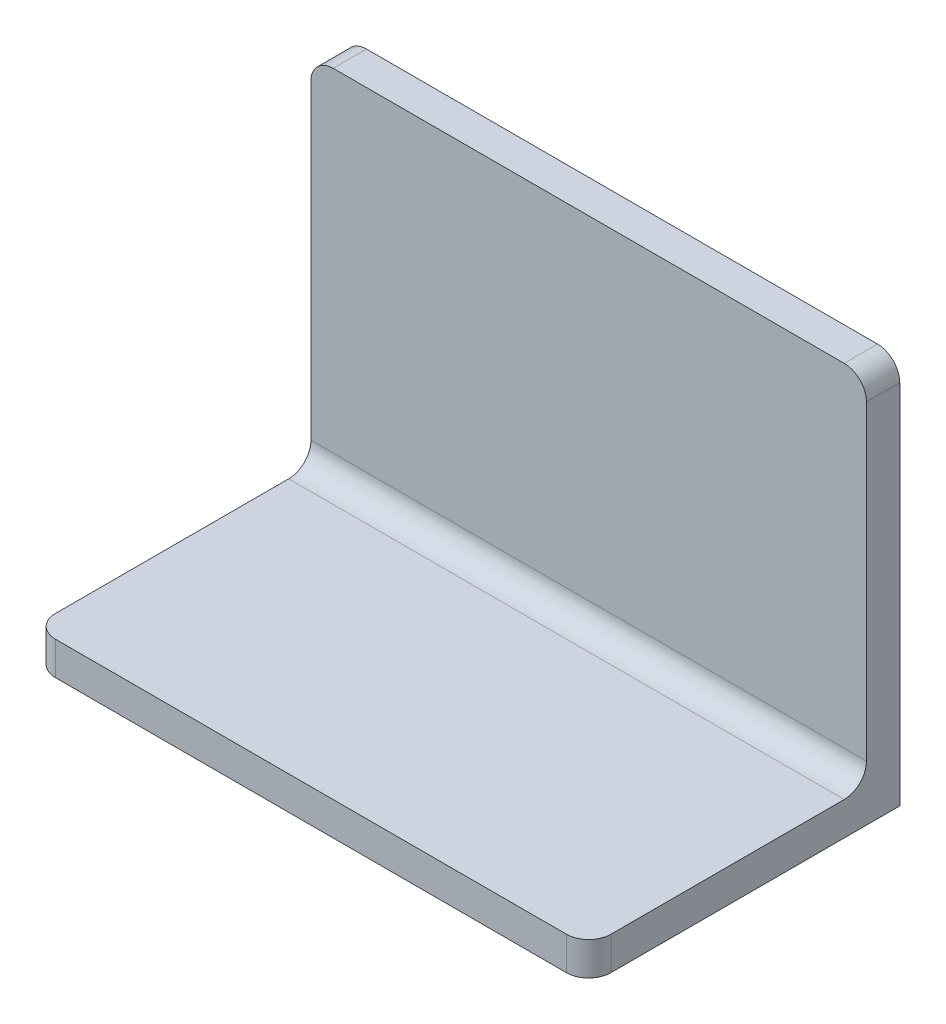
from build123d import *

# Parameters (mm, degrees)
SKETCH1_W           = 50
SKETCH1_H           = 35
BOSS_EXTRUDE1_DEPTH = 3
SKETCH3_W           = 50
SKETCH3_H           = 3
BOSS_EXTRUDE2_DEPTH = 25
FILLET1_R           = 2
FILLET2_R           = 2


with BuildPart() as part:
    # Sketch1 → Boss-Extrude1 (new body)
    with BuildSketch(Plane.XY):
        Rectangle(SKETCH1_W, SKETCH1_H)
    extrude(amount=BOSS_EXTRUDE1_DEPTH)

    # Sketch3 → Boss-Extrude2 (add)
    with BuildSketch(Plane.XY.offset(3)):
        with Locations((0, -16)):
            Rectangle(SKETCH3_W, SKETCH3_H)
    extrude(amount=BOSS_EXTRUDE2_DEPTH)

    # Fillet1
    fillet1_edges = [part.edges().sort_by_distance(p)[0] for p in [
        (0, -14.5, 3),
    ]]
    fillet(fillet1_edges, radius=FILLET1_R)

    # Fillet2
    fillet2_edges = [part.edges().sort_by_distance(p)[0] for p in [
        (-25, -16, 28),
        (25, -16, 28),
        (-25, 17.5, 1.5),
        (25, 17.5, 1.5),
    ]]
    fillet(fillet2_edges, radius=FILLET2_R)


solid = part.part
